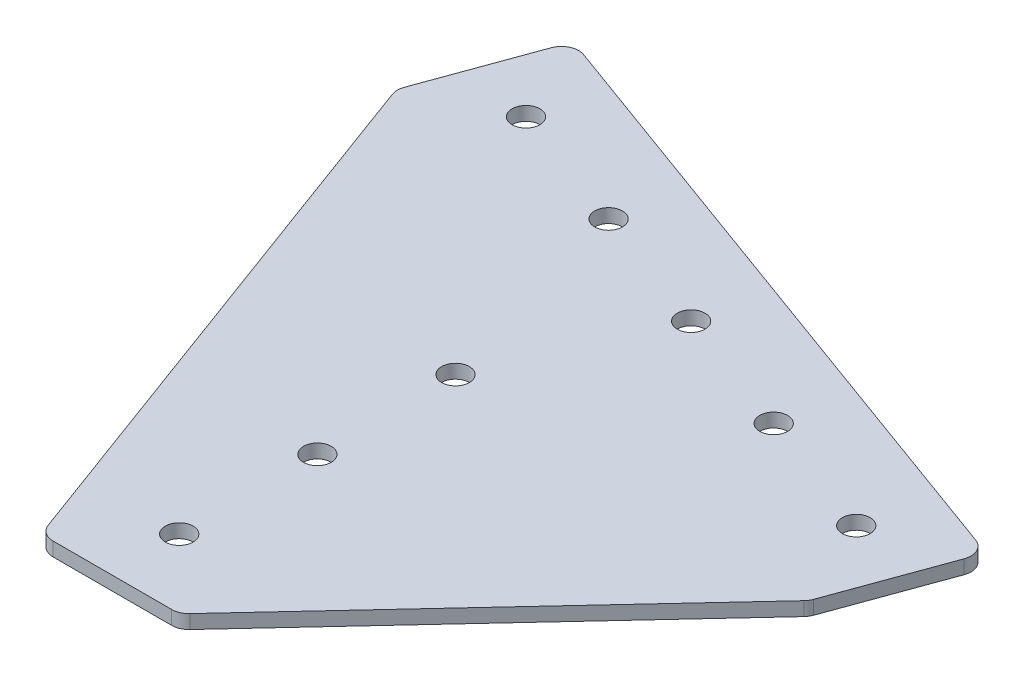
from build123d import *

# Parameters (mm, degrees)
BOSS_EXTRUDE1_DEPTH        = 2.54
F_7_0_201_DIAMETER_HOLE1_D = 5.1054
FILLET1_R                  = 3.175


with BuildPart() as part:
    # Sketch1 → Boss-Extrude1 (new body)
    with BuildSketch(Plane(origin=(0, 0, 0), x_dir=(1, 0, 0), z_dir=(0, 1, 0))):
        Polygon((0, 0), (-38.15203444, 103.451714303), (-29.4647228, 127.319906871), (89.87624004, 83.883348669), (81.1889284, 60.015156101), (25.4, 0), align=None)
    extrude(amount=BOSS_EXTRUDE1_DEPTH)

    # #7 (0.201) Diameter Hole1 (through all)
    with Locations(Plane(origin=(0, 0, 0), x_dir=(-1, 0, 0), z_dir=(0, -1, 0))):
        with Locations((-73.598487936, 76.292908205), (-49.730295368, 84.980219846), (-25.8621028, 93.667531486), (-1.993910232, 102.354843126), (21.874282336, 111.042154767), (-12.7, 63.5), (-12.7, 38.1), (-12.7, 12.7)):
            Hole(F_7_0_201_DIAMETER_HOLE1_D / 2)

    # Fillet1
    fillet1_edges = [part.edges().sort_by_distance(p)[0] for p in [
        (0, 1.27, 0),
        (-38.15203444, 1.27, -103.451714303),
        (-29.4647228, 1.27, -127.319906871),
        (89.87624004, 1.27, -83.883348669),
        (81.1889284, 1.27, -60.015156101),
        (25.4, 1.27, 0),
    ]]
    fillet(fillet1_edges, radius=FILLET1_R)


solid = part.part
